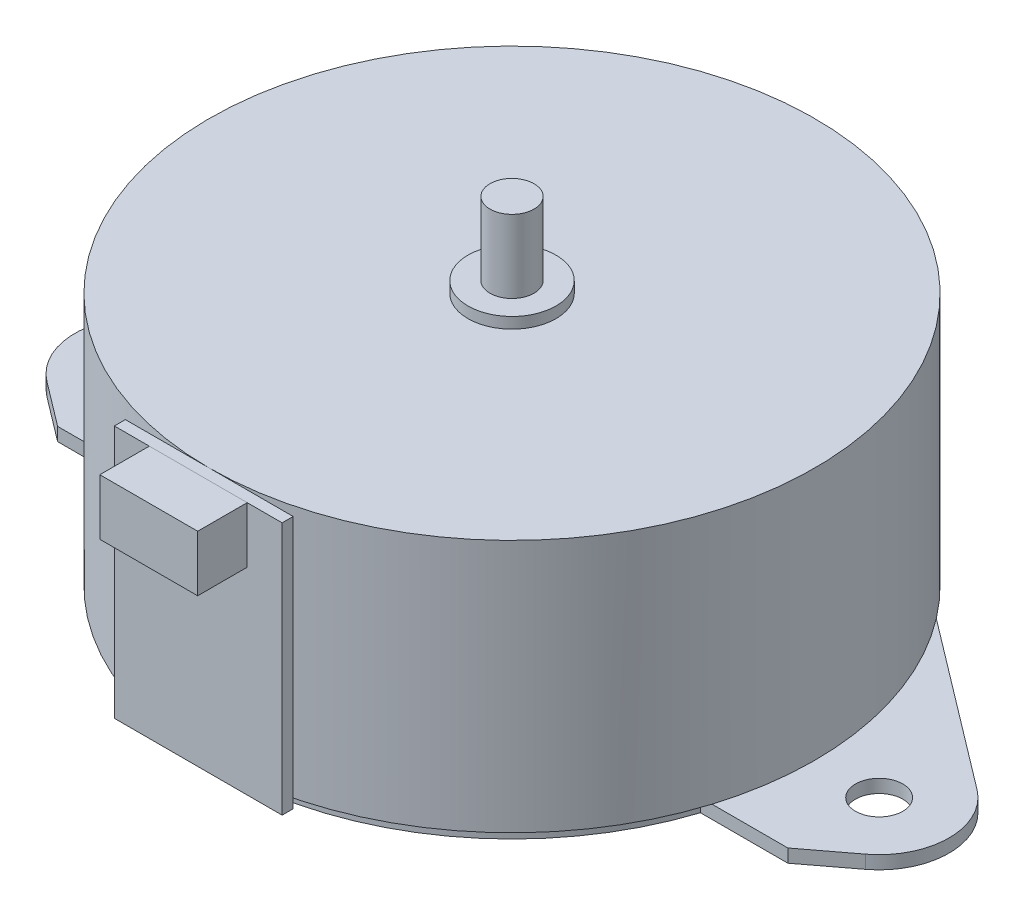
from build123d import *

# Parameters (mm, degrees)
SKETCH1_R        = 2.15
BASEPLATE_DEPTH  = 1.2
CASE_START       = 1.2
SKETCH2_R        = 27.5
CASE_2_DEPTH     = 23
SHAFT_DEPTH      = 9
SHAFT_DEPTH_BACK = 31.82
SKETCH3_R        = 2
SKETCH4_R        = 5.565
FRONTBOSS_DEPTH  = 2
SKETCH5_R        = 4
REARBOSS_DEPTH   = 1
PCB_START        = 27.5
SKETCH7_W        = 15.24
SKETCH7_H        = 23
PCB_DEPTH        = 1
SKETCH8_W        = 8.89
SKETCH8_H        = 5.08
PLUG_DEPTH       = 4.4958


with BuildPart() as part:
    # Sketch1 → BasePlate (new body)
    with BuildSketch(Plane(origin=(0, 0, 0), x_dir=(1, 0, 0), z_dir=(0, 1, 0))):
        with BuildLine():
            Line((-16.011244378, 21.116108862), (-37.186656672, 5.059897784))
            ThreePointArc((-37.186656672, 5.059897784), (-39.7, 0), (-37.186656672, -5.059897784))
            Line((-37.186656672, -5.059897784), (-33.164090473, -8.11))
            Line((-33.164090473, -8.11), (-25.22851363, -8.11))
            ThreePointArc((-25.22851363, -8.11), (0, -26.5), (25.22851363, -8.11))
            Line((25.22851363, -8.11), (33.164090473, -8.11))
            Line((33.164090473, -8.11), (37.186656672, -5.059897784))
            ThreePointArc((37.186656672, -5.059897784), (39.7, 0), (37.186656672, 5.059897784))
            Line((37.186656672, 5.059897784), (16.011244378, 21.116108862))
            ThreePointArc((16.011244378, 21.116108862), (0, 26.5), (-16.011244378, 21.116108862))
        make_face()
        with Locations(Location((-33.35, 0, 0), (0, 0, 270))):
            Circle(SKETCH1_R, mode=Mode.SUBTRACT)
        with Locations(Location((33.35, 0, 0), (0, 0, 90))):
            Circle(SKETCH1_R, mode=Mode.SUBTRACT)
    extrude(amount=BASEPLATE_DEPTH)

    # Sketch2 → Case 2 (add)
    with BuildSketch(Plane(origin=(0, 0, 0), x_dir=(1, 0, 0), z_dir=(0, 1, 0)).offset(CASE_START)):
        with Locations(Location((0, 0, 0), (0, 0, 37.330121736))):
            Circle(SKETCH2_R)
    extrude(amount=CASE_2_DEPTH)

    # Sketch3 → Shaft (add, two sides: drawn at the far end of the back side and taken through both)
    with BuildSketch(Plane.XZ.offset(-SHAFT_DEPTH_BACK)):
        with Locations(Location((0, 0, 0), (0, 0, 90))):
            Circle(SKETCH3_R)
    extrude(amount=SHAFT_DEPTH + SHAFT_DEPTH_BACK)

    # Sketch4 → FrontBoss (add)
    with BuildSketch(Plane.XZ):
        with Locations(Location((0, 0, 0), (0, 0, 90))):
            Circle(SKETCH4_R)
    extrude(amount=FRONTBOSS_DEPTH)

    # Sketch5 → RearBoss (add)
    with BuildSketch(Plane(origin=(0, 24.2, 0), x_dir=(1, 0, 0), z_dir=(0, 1, 0))):
        with Locations(Location((0, 0, 0), (0, 0, 270))):
            Circle(SKETCH5_R)
    extrude(amount=REARBOSS_DEPTH)


with BuildPart() as body_2:
    # Sketch7 → PCB (new body)
    with BuildSketch(Plane.XY.offset(PCB_START)):
        with Locations((0, 12.7)):
            Rectangle(SKETCH7_W, SKETCH7_H)
    extrude(amount=PCB_DEPTH)


with BuildPart() as body_3:
    # Sketch8 → Plug (new body)
    with BuildSketch(Plane.XY.offset(28.5)):
        with Locations((0, 21.66)):
            Rectangle(SKETCH8_W, SKETCH8_H)
    extrude(amount=PLUG_DEPTH)


solid = Compound([part.part, body_2.part, body_3.part])
